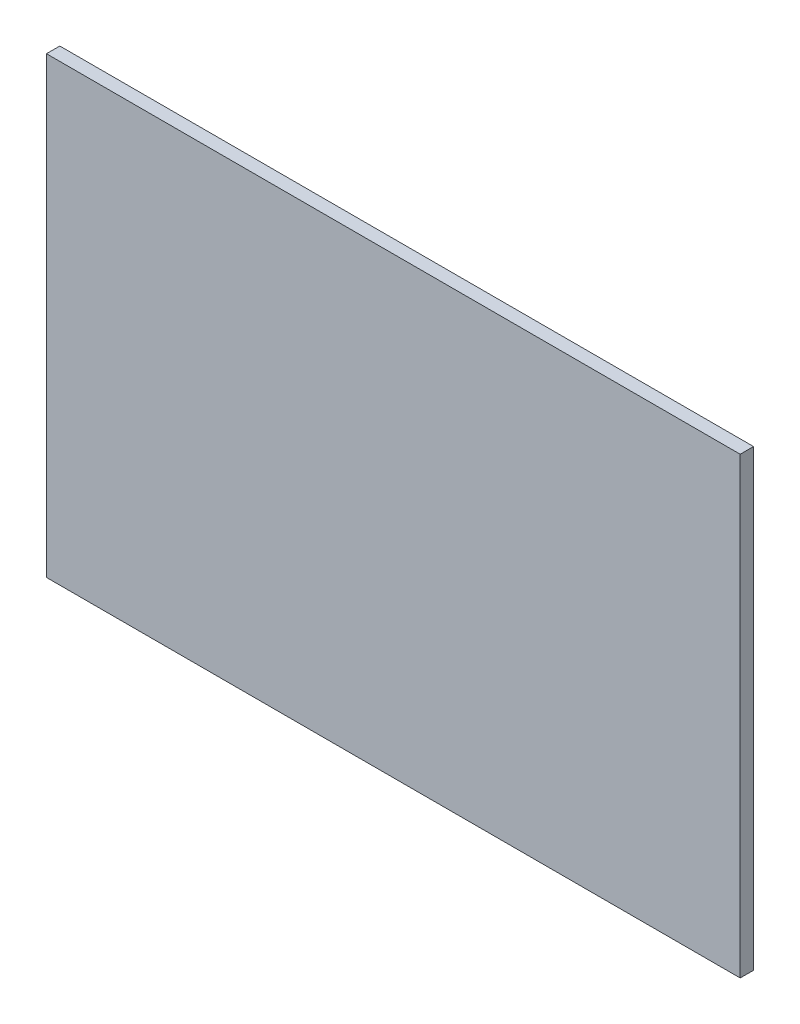
from build123d import *

# Parameters (mm, degrees)
SKETCH1_W           = 198.12
SKETCH1_H           = 129.54
BOSS_EXTRUDE1_DEPTH = 3.81


with BuildPart() as part:
    # Sketch1 → Boss-Extrude1 (new body)
    with BuildSketch(Plane.XY):
        Rectangle(SKETCH1_W, SKETCH1_H)
    extrude(amount=BOSS_EXTRUDE1_DEPTH)


solid = part.part
